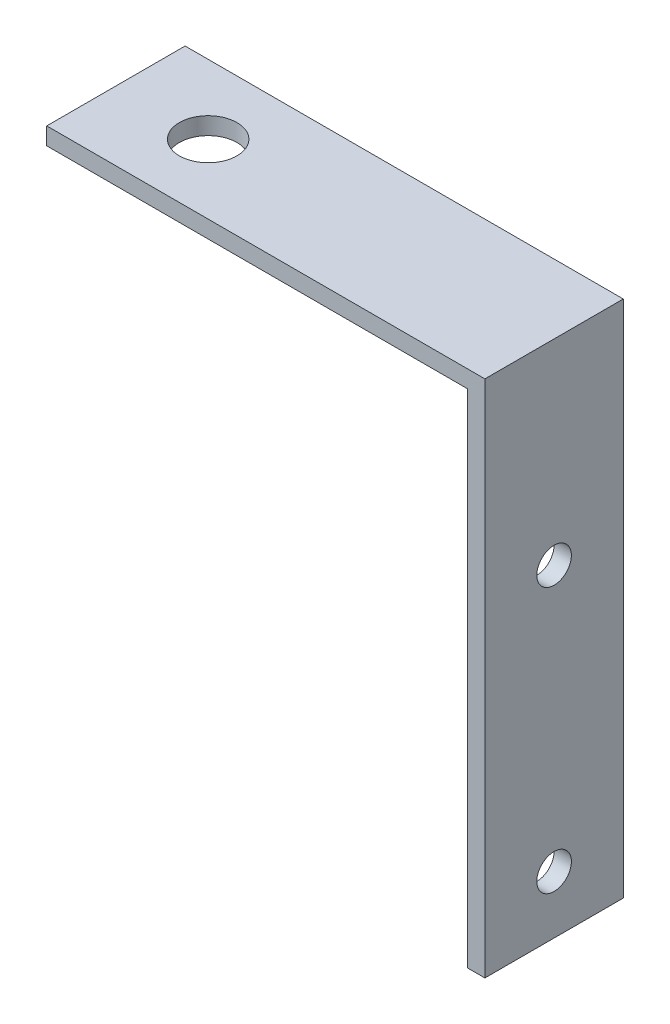
from build123d import *

# Parameters (mm, degrees)
SKETCH1_W           = 36.5
SKETCH1_H           = 12
BOSS_EXTRUDE1_DEPTH = 1.5
SKETCH1_3_W         = 1.5
SKETCH1_3_H         = 12
BOSS_EXTRUDE2_DEPTH = 45
SKETCH2_R           = 1.5
CUT_EXTRUDE1_DEPTH  = 60.203040462
SKETCH3_R           = 2.5
CUT_EXTRUDE2_DEPTH  = 30


with BuildPart() as part:
    # Sketch1 → Boss-Extrude1 (new body)
    with BuildSketch(Plane(origin=(0, 0, 0), x_dir=(1, 0, 0), z_dir=(0, 1, 0))):
        with Locations((-0.75, 0)):
            Rectangle(SKETCH1_W, SKETCH1_H)
    extrude(amount=-BOSS_EXTRUDE1_DEPTH)

    # Sketch1<3> → Boss-Extrude2 (add)
    with BuildSketch(Plane(origin=(0, 0, 0), x_dir=(1, 0, 0), z_dir=(0, 1, 0))):
        with Locations((18.25, 0)):
            Rectangle(SKETCH1_3_W, SKETCH1_3_H)
    extrude(amount=-BOSS_EXTRUDE2_DEPTH)

    # Sketch2 → Cut-Extrude1 (cut, through all)
    with BuildSketch(Plane(origin=(19, 0, 0), x_dir=(0, 0, -1), z_dir=(1, 0, 0))):
        with Locations((0, -40)):
            Circle(SKETCH2_R)
        with Locations((0, -17)):
            Circle(SKETCH2_R)
    extrude(amount=-CUT_EXTRUDE1_DEPTH, mode=Mode.SUBTRACT)

    # Sketch3 → Cut-Extrude2 (cut)
    with BuildSketch(Plane(origin=(0, 0, 0), x_dir=(1, 0, 0), z_dir=(0, 1, 0))):
        with Locations((-11, 0)):
            Circle(SKETCH3_R)
    extrude(amount=-CUT_EXTRUDE2_DEPTH, mode=Mode.SUBTRACT)


solid = part.part
